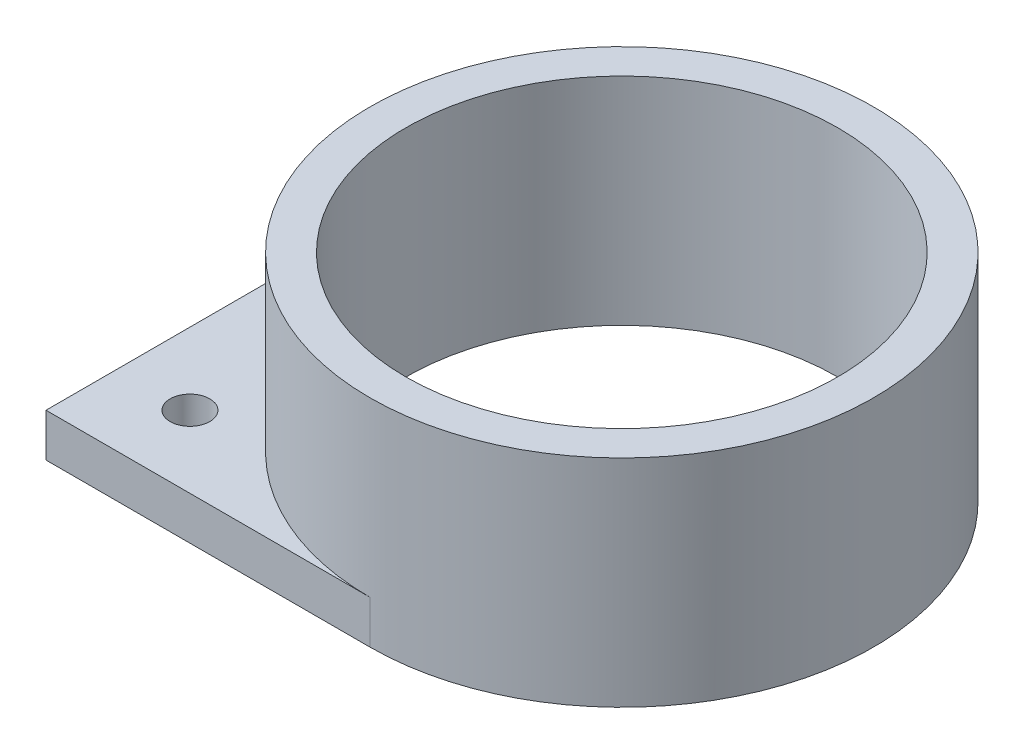
from build123d import *

# Parameters (mm, degrees)
SKETCH1_R                = 35
SKETCH1_R_2              = 30
BOSS_EXTRUDE1_DEPTH      = 30
BOSS_EXTRUDE2_DEPTH      = 6
M5_CLEARANCE_HOLE1_D     = 5.5
M5_CLEARANCE_HOLE1_DEPTH = 10
M5_CLEARANCE_HOLE1_TIP   = 1.652366702


with BuildPart() as part:
    # Sketch1 → Boss-Extrude1 (new body)
    with BuildSketch(Plane(origin=(0, 0, 0), x_dir=(1, 0, 0), z_dir=(0, 1, 0))):
        with Locations(Location((0, 0, 0), (0, 0, 270))):
            Circle(SKETCH1_R)
        with Locations(Location((0, 0, 0), (0, 0, 270))):
            Circle(SKETCH1_R_2, mode=Mode.SUBTRACT)
    extrude(amount=BOSS_EXTRUDE1_DEPTH)

    # Sketch2 → Boss-Extrude2 (add)
    with BuildSketch(Plane.XZ):
        with BuildLine():
            Line((0, -35), (-45, -35))
            Line((-45, -35), (-45, 35))
            Line((-45, 35), (0, 35))
            ThreePointArc((0, 35), (-35, 0), (0, -35))
        make_face()
    extrude(amount=-BOSS_EXTRUDE2_DEPTH)

    # M5 Clearance Hole1
    with Locations(Plane(origin=(0, 6, 0), x_dir=(1, 0, 0), z_dir=(0, 1, 0))):
        with Locations((-35, 25), (-35, -25)):
            Hole(M5_CLEARANCE_HOLE1_D / 2, depth=M5_CLEARANCE_HOLE1_DEPTH)
            with Locations((0, 0, -(M5_CLEARANCE_HOLE1_DEPTH + M5_CLEARANCE_HOLE1_TIP / 2))):  # 118° drill point
                Cone(0, M5_CLEARANCE_HOLE1_D / 2, M5_CLEARANCE_HOLE1_TIP, mode=Mode.SUBTRACT)


solid = part.part
